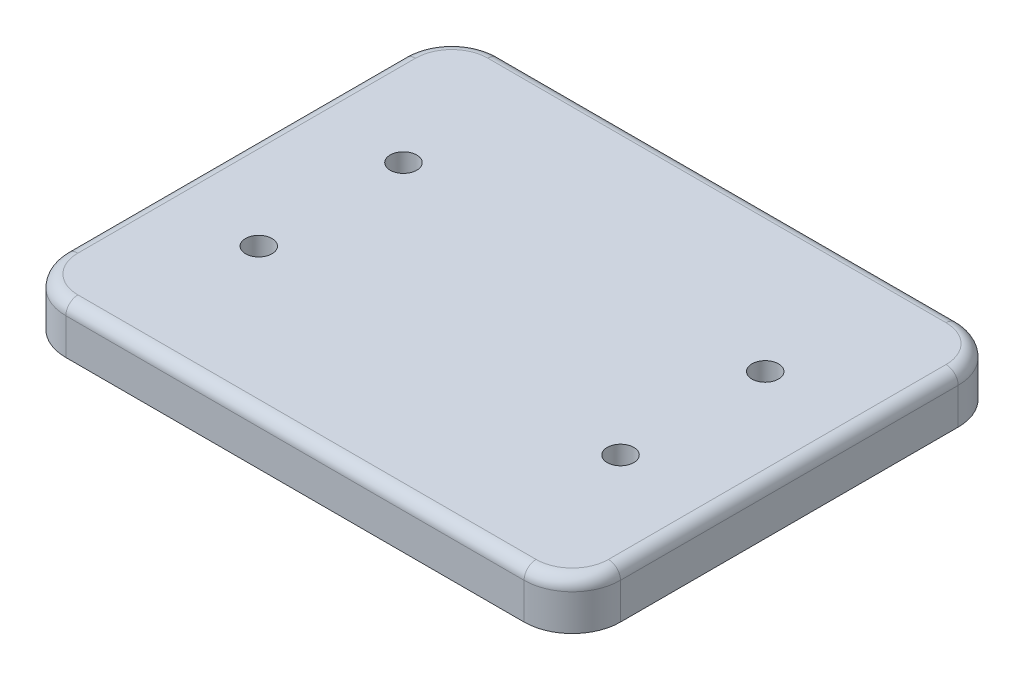
from build123d import *

# Parameters (mm, degrees)
BOSS_EXTRUDE1_DEPTH = 20
FILLET1_R           = 5
SKETCH4_R           = 5.5
CUT_EXTRUDE2_DEPTH  = 36
SKETCH5_R           = 9
CUT_EXTRUDE3_DEPTH  = 11


with BuildPart() as part:
    # Sketch1 → Boss-Extrude1 (new body)
    with BuildSketch(Plane(origin=(0, 0, 0), x_dir=(1, 0, 0), z_dir=(0, 1, 0))):
        with BuildLine():
            Line((-95, 90), (95, 90))
            ThreePointArc((95, 90), (109.142135624, 84.142135624), (115, 70))
            Line((115, 70), (115, -70))
            ThreePointArc((115, -70), (109.142135624, -84.142135624), (95, -90))
            Line((95, -90), (-95, -90))
            ThreePointArc((-95, -90), (-109.142135624, -84.142135624), (-115, -70))
            Line((-115, -70), (-115, 70))
            ThreePointArc((-115, 70), (-109.142135624, 84.142135624), (-95, 90))
        make_face()
    extrude(amount=BOSS_EXTRUDE1_DEPTH)

    # Fillet1
    fillet1_edges = [part.edges().sort_by_distance(p)[0] for p in [
        (109.142135624, 20, 84.142135624),
        (115, 20, 0),
        (109.142135624, 20, -84.142135624),
        (0, 20, -90),
        (-109.142135624, 20, -84.142135624),
        (-115, 20, 0),
        (-109.142135624, 20, 84.142135624),
        (0, 20, 90),
    ]]
    fillet(fillet1_edges, radius=FILLET1_R)

    # Sketch4 → Cut-Extrude2 (cut)
    with BuildSketch(Plane(origin=(0, 0, 0), x_dir=(1, 0, 0), z_dir=(0, 1, 0))):
        with Locations(Location((-75, 30, 0), (0, 0, 90))):
            Circle(SKETCH4_R)
        with Locations(Location((75, 30, 0), (0, 0, 90))):
            Circle(SKETCH4_R)
    cut_extrude2 = extrude(amount=CUT_EXTRUDE2_DEPTH, mode=Mode.SUBTRACT)

    # Sketch5 → Cut-Extrude3 (cut)
    with BuildSketch(Plane.XZ):
        with Locations(Location((-75, -30, 0), (0, 0, 270))):
            Circle(SKETCH5_R)
        with Locations(Location((75, -30, 0), (0, 0, 270))):
            Circle(SKETCH5_R)
    cut_extrude3 = extrude(amount=-CUT_EXTRUDE3_DEPTH, mode=Mode.SUBTRACT)

    # Mirror1: Cut-Extrude2, Cut-Extrude3 across plane
    add(cut_extrude2.mirror(Plane.XY), mode=Mode.SUBTRACT)
    add(cut_extrude3.mirror(Plane.XY), mode=Mode.SUBTRACT)


solid = part.part
